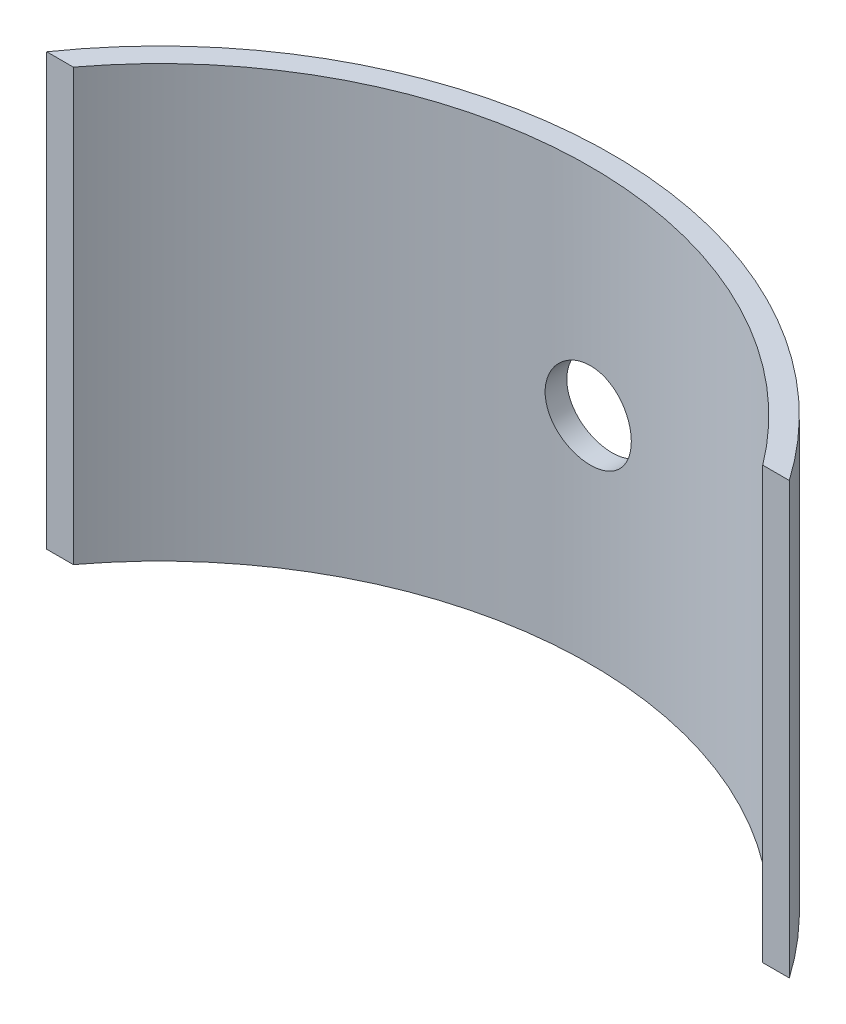
from build123d import *

# Parameters (mm, degrees)
BOSS_EXTRUDE1_DEPTH     = 25
CUT_EXTRUDE1_DEPTH      = 55.155447556
CUT_EXTRUDE1_DEPTH_BACK = 55.155447556
SKETCH2_R               = 5


with BuildPart() as part:
    # Sketch1 → Boss-Extrude1 (new, symmetric)
    with BuildSketch(Plane(origin=(0, 0, 0), x_dir=(1, 0, 0), z_dir=(0, 1, 0))):
        with BuildLine():
            Line((-43.084219849, 30), (-40, 30))
            ThreePointArc((-40, 30), (0, 50), (40, 30))
            Line((40, 30), (43.084219849, 30))
            ThreePointArc((43.084219849, 30), (0, 52.5), (-43.084219849, 30))
        make_face()
    extrude(amount=BOSS_EXTRUDE1_DEPTH, both=True)

    # Sketch2 → Cut-Extrude1 (cut, two sides: drawn at the far end of the back side and taken through both)
    with BuildSketch(Plane.XY.offset(-51.25).offset(-CUT_EXTRUDE1_DEPTH_BACK)):
        Circle(SKETCH2_R)
    extrude(amount=CUT_EXTRUDE1_DEPTH + CUT_EXTRUDE1_DEPTH_BACK, mode=Mode.SUBTRACT)


solid = part.part
